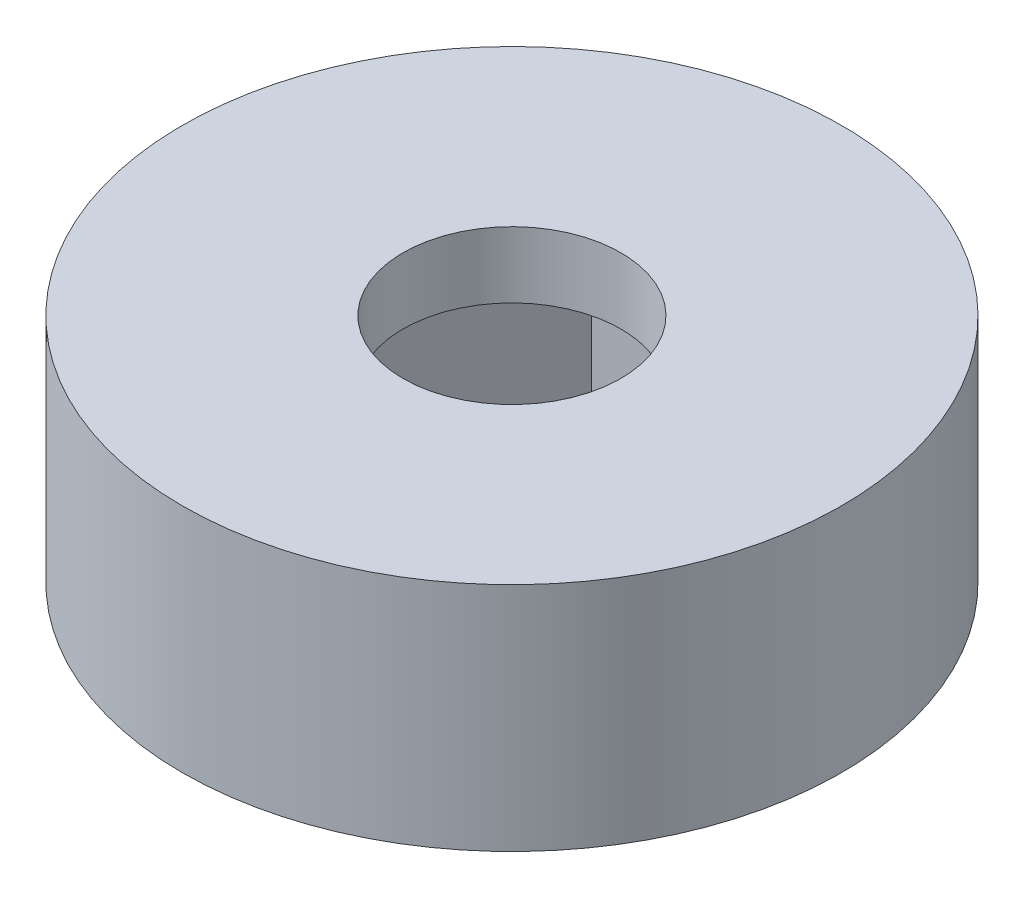
from build123d import *

# Parameters (mm, degrees)
SKETCH_1_R      = 4.990896534
EXTRUDE_1_DEPTH = 2.5
SKETCH_2_R      = 4.990896534
SKETCH_2_R_2    = 1.65
EXTRUDE_2_DEPTH = 1


with BuildPart() as part:
    # 草图1 → 凸台-拉伸1 (new body)
    with BuildSketch(Plane(origin=(0, 0, 0), x_dir=(1, 0, 0), z_dir=(0, 1, 0))):
        with Locations(Location((0, 0, 0), (0, 0, 270))):
            Circle(SKETCH_1_R)
        Polygon((1.645448267, -2.85), (3.290896534, 0), (1.645448267, 2.85), (-1.645448267, 2.85), (-3.290896534, 0), (-1.645448267, -2.85), align=None, mode=Mode.SUBTRACT)
    extrude(amount=EXTRUDE_1_DEPTH)

    # 草图2 → 凸台-拉伸2 (add)
    with BuildSketch(Plane(origin=(0, 2.5, 0), x_dir=(1, 0, 0), z_dir=(0, 1, 0))):
        with Locations(Location((0, 0, 0), (0, 0, 270))):
            Circle(SKETCH_2_R)
        with Locations(Location((0, 0, 0), (0, 0, 270))):
            Circle(SKETCH_2_R_2, mode=Mode.SUBTRACT)
    extrude(amount=EXTRUDE_2_DEPTH)


solid = part.part
